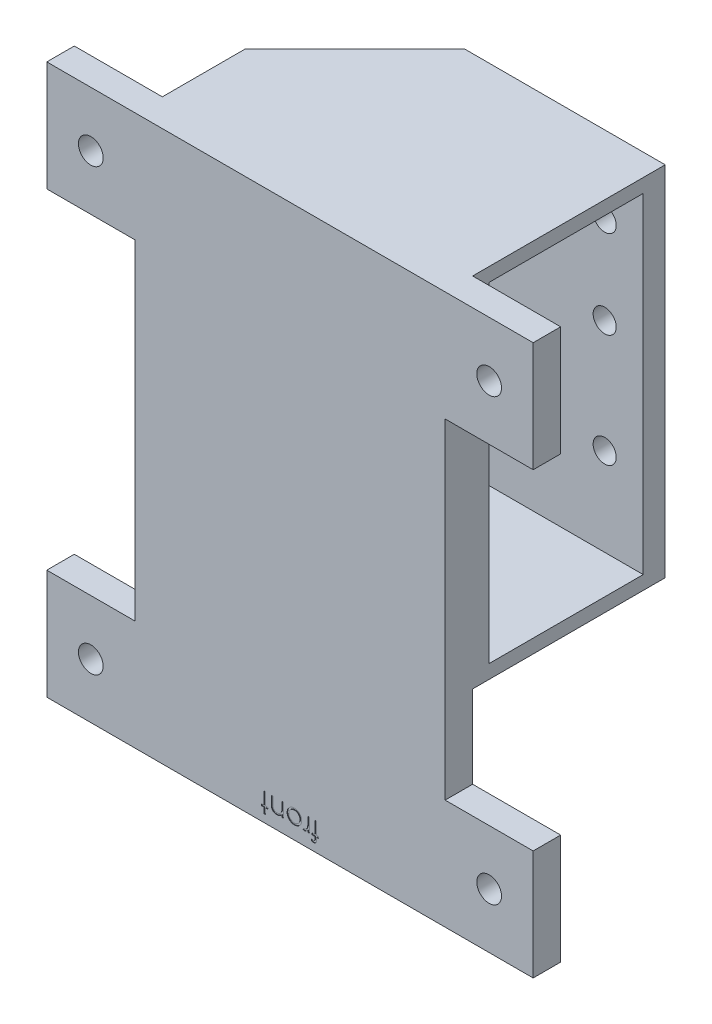
from build123d import *

# Parameters (mm, degrees)
SKETCH_2_W          = 56.4
SKETCH_2_H          = 100
EXTRUDE_1_DEPTH     = 40
CUT_EXTRUDE_1_DEPTH = 0.1
SKETCH_4_R          = 2.1
CUT_EXTRUDE_2_DEPTH = 20
SKETCH_6_W          = 5
SKETCH_6_H          = 20
EXTRUDE_2_DEPTH     = 16
HOLE_WIZARD_M4_1_D  = 4.5
SKETCH_10_W         = 35
SKETCH_10_H         = 35
CUT_EXTRUDE_3_DEPTH = 97.65278078
CHAMFER_3_SIZE      = 20
SKETCH_11_W         = 28
SKETCH_11_H         = 60
CUT_EXTRUDE_4_DEPTH = 97.65278078


with BuildPart() as part:
    # 스케치2 → 보스-돌출1 (new body)
    with BuildSketch(Plane.XY):
        Rectangle(SKETCH_2_W, SKETCH_2_H)
    extrude(amount=EXTRUDE_1_DEPTH)

    # 스케치3 → 컷-돌출1 (cut)
    # profile 1 of 5: a face of its own
    with BuildSketch(Plane.XY.offset(40)):
        Polygon((-4.419871795, -48.58974359), (-4.733974359, -48.58974359), (-4.733974359, -47.557692308), (-5.182692308, -47.557692308), (-5.182692308, -47.243589744), (-4.733974359, -47.243589744), (-4.733974359, -45), (-4.419871795, -45), (-4.419871795, -47.243589744), (-3.971153846, -47.243589744), (-3.971153846, -47.557692308), (-4.419871795, -47.557692308), align=None)
    # profile 2 of 5: a face of its own
    with BuildSketch(Plane.XY.offset(40)):
        with BuildLine():
            Line((-1.144230769, -47.557692308), (-1.458333333, -47.557692308))
            Line((-1.458333333, -47.557692308), (-1.458333333, -47.096354167))
            add(Edge.make_bspline(
                [(-1.458333333, -47.096354167), (-1.491813075, -47.138259455), (-1.556679638, -47.219450404), (-1.665816274, -47.325322597), (-1.779613315, -47.414166302), (-1.899919005, -47.484117946), (-2.025495371, -47.537022548), (-2.155986094, -47.575173001), (-2.292097456, -47.598061986), (-2.384662349, -47.60105165), (-2.431490385, -47.602564103)],
                knots=[0, 0, 0, 0, 1.127869841, 2.185233117, 3.191641716, 4.159226741, 5.10472073, 6.052603964, 7.014823782, 8, 8, 8, 8], degree=3))
            add(Edge.make_bspline(
                [(-2.431490385, -47.602564103), (-2.478843611, -47.600917497), (-2.571571757, -47.597693077), (-2.706097483, -47.56928172), (-2.83262, -47.524320566), (-2.949447493, -47.461129878), (-3.054782332, -47.382674567), (-3.146125592, -47.290645903), (-3.222940631, -47.186152591), (-3.274211104, -47.088344399), (-3.307372302, -47.001465675), (-3.329164538, -46.927156014), (-3.346794921, -46.84433245), (-3.362592431, -46.753199763), (-3.373131104, -46.653391918), (-3.381484961, -46.545147131), (-3.387460243, -46.428484144), (-3.38769794, -46.347797639), (-3.387820513, -46.306189904)],
                knots=[0, 0, 0, 0, 1.235764162, 2.419900973, 3.574701258, 4.732869372, 5.875730734, 6.993815468, 8.107424371, 9.251605764, 9.866123335, 10.534503958, 11.272175692, 12.077112099, 12.949509943, 13.89253218, 14.913238789, 16, 16, 16, 16], degree=3))
            Line((-3.387820513, -46.306189904), (-3.387820513, -45))
            Line((-3.387820513, -45), (-3.073717949, -45))
            Line((-3.073717949, -45), (-3.073717949, -46.203125))
            add(Edge.make_bspline(
                [(-3.073717949, -46.203125), (-3.07352554, -46.237947495), (-3.073157496, -46.304557001), (-3.071981473, -46.399925376), (-3.06921317, -46.486180825), (-3.065163262, -46.563571239), (-3.059494414, -46.631813366), (-3.053425809, -46.691252631), (-3.046065484, -46.741362537), (-3.039502072, -46.77152758), (-3.036558494, -46.78505609)],
                knots=[0, 0, 0, 0, 1.430803381, 2.736883362, 3.918614142, 4.976458302, 5.92063272, 6.731858525, 7.431260095, 8, 8, 8, 8], degree=3))
            add(Edge.make_bspline(
                [(-3.036558494, -46.78505609), (-3.025985705, -46.824795804), (-3.005690479, -46.901079039), (-2.954520462, -47.004374389), (-2.891402794, -47.093030698), (-2.81320145, -47.165224631), (-2.722016726, -47.221425751), (-2.617697035, -47.260391137), (-2.501322033, -47.284769891), (-2.419467122, -47.287196662), (-2.376802885, -47.288461538)],
                knots=[0, 0, 0, 0, 1.084232, 2.08126119, 3.027460722, 3.945137793, 4.874029258, 5.839697328, 6.874011781, 8, 8, 8, 8], degree=3))
            add(Edge.make_bspline(
                [(-2.376802885, -47.288461538), (-2.351532866, -47.28799256), (-2.301524152, -47.287064464), (-2.227408227, -47.277510712), (-2.155289136, -47.262421763), (-2.085360089, -47.240134352), (-2.017479764, -47.213035974), (-1.951367258, -47.17978499), (-1.887946354, -47.139565105), (-1.826325262, -47.094357903), (-1.769051064, -47.044014008), (-1.714998855, -46.991659858), (-1.667507302, -46.935103257), (-1.624398244, -46.876343857), (-1.587230651, -46.814201305), (-1.554774704, -46.749339869), (-1.527239774, -46.681656952), (-1.513556979, -46.634681994), (-1.506710737, -46.611177885)],
                knots=[0, 0, 0, 0, 1.023939463, 2.026349741, 3.024227553, 4.007104963, 4.997624259, 5.984875705, 7.002218968, 8.038748769, 9.079772093, 10.091408226, 11.086177727, 12.069739863, 13.043026652, 14.017557731, 15.008077027, 16, 16, 16, 16], degree=3))
            add(Edge.make_bspline(
                [(-1.506710737, -46.611177885), (-1.502771089, -46.593922682), (-1.49419468, -46.556359007), (-1.4849315, -46.494714588), (-1.476523924, -46.423404613), (-1.469486966, -46.342512296), (-1.465181549, -46.251754421), (-1.460487153, -46.151518583), (-1.458778092, -46.041405094), (-1.458485738, -45.964743402), (-1.458333333, -45.924779647)],
                knots=[0, 0, 0, 0, 0.615963638, 1.340920617, 2.168419149, 3.115676021, 4.16674242, 5.331190069, 6.6087489, 8, 8, 8, 8], degree=3))
            Line((-1.458333333, -45.924779647), (-1.458333333, -45))
            Line((-1.458333333, -45), (-1.144230769, -45))
            Line((-1.144230769, -45), (-1.144230769, -47.557692308))
        make_face()
    # profile 3 of 5: a face of its own
    with BuildSketch(Plane.XY.offset(40)):
        with BuildLine():
            add(Edge.make_bspline(
                [(0.806290064, -47.602564103), (0.7582976, -47.60154521), (0.664196106, -47.599547412), (0.52640509, -47.57808998), (0.395011363, -47.545551155), (0.269451285, -47.499748526), (0.150763491, -47.439653687), (0.037888294, -47.366981145), (-0.068948154, -47.281239229), (-0.132968513, -47.214875573), (-0.165464744, -47.181189904)],
                knots=[0, 0, 0, 0, 1.054042676, 2.066720093, 3.05716247, 4.025731183, 4.997454851, 5.974904663, 6.97207755, 8, 8, 8, 8], degree=3))
            add(Edge.make_bspline(
                [(-0.165464744, -47.181189904), (-0.193446698, -47.148975918), (-0.248869078, -47.085171376), (-0.319934797, -46.981715763), (-0.381156357, -46.874575662), (-0.430219318, -46.762328336), (-0.468904342, -46.645953664), (-0.496370038, -46.525051653), (-0.512706973, -46.399889306), (-0.51490994, -46.314885468), (-0.516025641, -46.271834936)],
                knots=[0, 0, 0, 0, 1.025258237, 2.030674902, 3.01204498, 3.988269485, 4.97094183, 5.956517959, 6.965070386, 8, 8, 8, 8], degree=3))
            add(Edge.make_bspline(
                [(-0.516025641, -46.271834936), (-0.515044304, -46.228534878), (-0.513105135, -46.142971945), (-0.494761519, -46.01695258), (-0.466230434, -45.894757754), (-0.42539859, -45.776899073), (-0.373040504, -45.663016196), (-0.309149729, -45.553606839), (-0.233278447, -45.448453965), (-0.147273151, -45.348454996), (-0.052226121, -45.25627808), (0.050907576, -45.175988565), (0.160175955, -45.106912047), (0.277070637, -45.052046085), (0.399927663, -45.007820299), (0.529528481, -44.977323772), (0.665757476, -44.958720064), (0.758786933, -44.956342333), (0.806290064, -44.955128205)],
                knots=[0, 0, 0, 0, 0.998669827, 1.973418153, 2.932281609, 3.89081133, 4.846438734, 5.82045571, 6.809776312, 7.834649874, 8.860672198, 9.859676908, 10.845817165, 11.837296335, 12.833502054, 13.853824644, 14.904110009, 16, 16, 16, 16], degree=3))
            add(Edge.make_bspline(
                [(0.806290064, -44.955128205), (0.854023648, -44.956352379), (0.947512284, -44.958749984), (1.084254238, -44.977185387), (1.214400716, -45.008146141), (1.337838885, -45.05149858), (1.454733093, -45.107362699), (1.564404947, -45.175719795), (1.66758729, -45.256318736), (1.762664119, -45.34844398), (1.848661426, -45.448456803), (1.924534769, -45.553606102), (1.988425008, -45.663016387), (2.040783235, -45.776899022), (2.081615042, -45.894757767), (2.110146136, -46.016952576), (2.12848975, -46.142971946), (2.130428919, -46.228534878), (2.131410256, -46.271834936)],
                knots=[0, 0, 0, 0, 1.099861214, 2.154133753, 3.1731438, 4.178222029, 5.163564916, 6.153006591, 7.15072618, 8.175428628, 9.198983792, 10.187031731, 11.15979573, 12.114193814, 13.071490482, 14.029120454, 15.002614863, 16, 16, 16, 16], degree=3))
            add(Edge.make_bspline(
                [(2.131410256, -46.271834936), (2.130289615, -46.314652437), (2.128070937, -46.399423731), (2.111711707, -46.52433693), (2.084544859, -46.644868911), (2.04532355, -46.760608083), (1.996351665, -46.872585626), (1.935746273, -46.98011856), (1.863993113, -47.083122115), (1.808786047, -47.146842045), (1.780849359, -47.179086538)],
                knots=[0, 0, 0, 0, 1.031377469, 2.041950136, 3.029500481, 4.003457997, 4.981637986, 5.969878303, 6.97268806, 8, 8, 8, 8], degree=3))
            add(Edge.make_bspline(
                [(1.780849359, -47.179086538), (1.748399431, -47.213058664), (1.684580938, -47.279870826), (1.577251317, -47.365443569), (1.464861671, -47.439095912), (1.3454083, -47.499160507), (1.219499093, -47.54546805), (1.087128821, -47.578241849), (0.948836273, -47.5994525), (0.854279, -47.601516565), (0.806290064, -47.602564103)],
                knots=[0, 0, 0, 0, 1.027951202, 2.021646915, 2.998468564, 3.9668038, 4.943370589, 5.93035926, 6.949632805, 8, 8, 8, 8], degree=3))
        make_face()
        with BuildLine():
            add(Edge.make_bspline(
                [(0.807692308, -47.288461538), (0.841629881, -47.287496895), (0.908628935, -47.285592509), (1.007249068, -47.271109357), (1.102187192, -47.248159071), (1.19363552, -47.215565268), (1.281240443, -47.173427664), (1.365098035, -47.121963826), (1.444984221, -47.060900209), (1.520280567, -46.991448366), (1.590209154, -46.916018035), (1.650583019, -46.834883677), (1.702304852, -46.750299777), (1.744565818, -46.661788259), (1.776988183, -46.569105953), (1.799960451, -46.472783139), (1.81447109, -46.372533135), (1.816351915, -46.304369998), (1.817307692, -46.269731571)],
                knots=[0, 0, 0, 0, 1.021608339, 2.016844023, 2.99486249, 3.958675159, 4.934437641, 5.916902129, 6.916234728, 7.957219854, 8.998204981, 10.008773588, 10.997243553, 11.979355116, 12.956436335, 13.948132639, 14.957303585, 16, 16, 16, 16], degree=3))
            add(Edge.make_bspline(
                [(1.817307692, -46.269731571), (1.815705109, -46.224977566), (1.81252428, -46.136149235), (1.786526694, -46.005367193), (1.743343492, -45.879576721), (1.68379675, -45.760292369), (1.610463145, -45.64973484), (1.524714534, -45.550320988), (1.425365412, -45.465884611), (1.315798809, -45.394872197), (1.197567421, -45.338949987), (1.072653449, -45.298846326), (0.942194273, -45.273127506), (0.852918677, -45.270541049), (0.807692308, -45.269230769)],
                knots=[0, 0, 0, 0, 1.016977094, 2.018509362, 3.018404954, 4.033172147, 5.041280572, 6.028085189, 7.007940189, 7.995502847, 8.989109012, 9.972200833, 10.97273166, 12, 12, 12, 12], degree=3))
            add(Edge.make_bspline(
                [(0.807692308, -45.269230769), (0.762463337, -45.270533459), (0.673182606, -45.273104934), (0.542541912, -45.298976626), (0.417285591, -45.338775602), (0.298931273, -45.394935358), (0.189314773, -45.465616203), (0.090675073, -45.550802015), (0.004188006, -45.649473499), (-0.069218213, -45.760145777), (-0.127805493, -45.879762163), (-0.171191772, -46.005344015), (-0.197127009, -46.136155138), (-0.200316253, -46.224979543), (-0.201923077, -46.269731571)],
                knots=[0, 0, 0, 0, 1.027082318, 2.027431966, 3.015401697, 4.008827937, 4.996211763, 5.971861488, 6.96198607, 7.969911943, 8.982141629, 9.981856156, 10.983207064, 12, 12, 12, 12], degree=3))
            add(Edge.make_bspline(
                [(-0.201923077, -46.269731571), (-0.20097446, -46.304372782), (-0.199107725, -46.372541399), (-0.184494602, -46.47275155), (-0.161882916, -46.569297787), (-0.128062672, -46.661414463), (-0.087274069, -46.750730658), (-0.034298302, -46.83463036), (0.025794506, -46.916069502), (0.095851282, -46.991402925), (0.171139175, -47.06115396), (0.251625502, -47.121741385), (0.33552204, -47.173457052), (0.423154649, -47.215570458), (0.514396033, -47.248033617), (0.60904592, -47.271209331), (0.707229317, -47.285539702), (0.773990463, -47.287481364), (0.807692308, -47.288461538)],
                knots=[0, 0, 0, 0, 1.043037354, 2.052538279, 3.044558847, 4.0243144, 5.003741121, 5.996211188, 7.007110229, 8.048435736, 9.089761243, 10.095031504, 11.077817236, 12.053898772, 13.018026588, 13.989527945, 14.985089051, 16, 16, 16, 16], degree=3))
        make_face(mode=Mode.SUBTRACT)
    # profile 4 of 5: a face of its own
    with BuildSketch(Plane.XY.offset(40)):
        with BuildLine():
            Line((3.567307692, -47.557692308), (3.253205128, -47.557692308))
            Line((3.253205128, -47.557692308), (3.253205128, -47.181189904))
            add(Edge.make_bspline(
                [(3.253205128, -47.181189904), (3.230033987, -47.216265089), (3.18571936, -47.283346107), (3.111673415, -47.371889133), (3.036660026, -47.446366501), (2.958127307, -47.504295055), (2.878072367, -47.548438601), (2.796732034, -47.57972352), (2.713519296, -47.598792734), (2.657348566, -47.601305296), (2.629206731, -47.602564103)],
                knots=[0, 0, 0, 0, 1.280240866, 2.448450709, 3.511242029, 4.49418232, 5.41222037, 6.289222348, 7.142891256, 8, 8, 8, 8], degree=3))
            add(Edge.make_bspline(
                [(2.629206731, -47.602564103), (2.607373332, -47.60140021), (2.562677098, -47.599017547), (2.494810983, -47.581439148), (2.42459977, -47.554439176), (2.379291072, -47.52842766), (2.355769231, -47.514923878)],
                knots=[0, 0, 0, 0, 0.90119973, 1.844890732, 2.881183062, 4, 4, 4, 4], degree=3))
            Line((2.355769231, -47.514923878), (2.528245192, -47.242888622))
            add(Edge.make_bspline(
                [(2.528245192, -47.242888622), (2.543354213, -47.249628888), (2.572034028, -47.262423203), (2.613988594, -47.277565213), (2.652669931, -47.286481129), (2.677313489, -47.287831847), (2.688802083, -47.288461538)],
                knots=[0, 0, 0, 0, 1.180555205, 2.24091978, 3.179933427, 4, 4, 4, 4], degree=3))
            add(Edge.make_bspline(
                [(2.688802083, -47.288461538), (2.714268674, -47.286856573), (2.765749172, -47.283612149), (2.840969444, -47.25589188), (2.914937028, -47.214230078), (2.972382123, -47.165086568), (3.0173577, -47.118779982), (3.049723563, -47.078030433), (3.078791731, -47.03194585), (3.106982735, -46.982271823), (3.133175951, -46.92777205), (3.156582974, -46.868354637), (3.178473187, -46.804511093), (3.190800723, -46.760119153), (3.197115385, -46.737379808)],
                knots=[0, 0, 0, 0, 1.1355652, 2.295535532, 3.545064593, 4.917862323, 5.656949634, 6.430545574, 7.239270929, 8.090880714, 8.983622437, 9.940313733, 10.94494545, 12, 12, 12, 12], degree=3))
            add(Edge.make_bspline(
                [(3.197115385, -46.737379808), (3.201855957, -46.717103757), (3.212408618, -46.671968634), (3.222395011, -46.596591234), (3.232659394, -46.507592607), (3.239668935, -46.404869363), (3.246290381, -46.288026631), (3.24994834, -46.157568472), (3.253088745, -46.013136318), (3.253165096, -45.912395458), (3.253205128, -45.859575321)],
                knots=[0, 0, 0, 0, 0.566841273, 1.261806378, 2.068780918, 3.007109044, 4.065315289, 5.256255371, 6.561408263, 8, 8, 8, 8], degree=3))
            Line((3.253205128, -45.859575321), (3.253205128, -45))
            Line((3.253205128, -45), (3.567307692, -45))
            Line((3.567307692, -45), (3.567307692, -47.557692308))
        make_face()
    # profile 5 of 5: a face of its own
    with BuildSketch(Plane.XY.offset(40)):
        with BuildLine():
            Line((3.926282051, -48.568709936), (3.926282051, -48.241987179))
            add(Edge.make_bspline(
                [(3.926282051, -48.241987179), (3.956020831, -48.253938052), (4.012465651, -48.276621056), (4.095706028, -48.301285681), (4.172234861, -48.317221421), (4.221388751, -48.319457366), (4.244591346, -48.320512821)],
                knots=[0, 0, 0, 0, 1.16548392, 2.212112691, 3.15604595, 4, 4, 4, 4], degree=3))
            add(Edge.make_bspline(
                [(4.244591346, -48.320512821), (4.260506628, -48.319901347), (4.29086446, -48.318734983), (4.334597978, -48.311913229), (4.373878754, -48.29942109), (4.408524105, -48.281814066), (4.43736084, -48.260709259), (4.462146155, -48.239226826), (4.480074637, -48.215042461), (4.489950849, -48.19253823), (4.495611497, -48.171610651), (4.498818247, -48.150454135), (4.501587796, -48.12378309), (4.503354012, -48.091715067), (4.50570618, -48.054579141), (4.50697213, -48.012027215), (4.507671623, -47.964111878), (4.507566904, -47.930222012), (4.507512019, -47.912459936)],
                knots=[0, 0, 0, 0, 1.331338734, 2.53948105, 3.689136299, 4.764273871, 5.773054392, 6.672324186, 7.497148657, 8.267121549, 8.712809866, 9.307239488, 10.054042404, 10.955009736, 11.992538323, 13.165873169, 14.514600855, 16, 16, 16, 16], degree=3))
            Line((4.507512019, -47.912459936), (4.507512019, -47.557692308))
            Line((4.507512019, -47.557692308), (3.971153846, -47.557692308))
            Line((3.971153846, -47.557692308), (3.971153846, -47.243589744))
            Line((3.971153846, -47.243589744), (4.508213141, -47.243589744))
            Line((4.508213141, -47.243589744), (4.509615385, -45))
            Line((4.509615385, -45), (4.823717949, -45))
            Line((4.823717949, -45), (4.823717949, -47.243589744))
            Line((4.823717949, -47.243589744), (5.182692308, -47.243589744))
            Line((5.182692308, -47.243589744), (5.182692308, -47.557692308))
            Line((5.182692308, -47.557692308), (4.823717949, -47.557692308))
            Line((4.823717949, -47.557692308), (4.823717949, -47.966446314))
            add(Edge.make_bspline(
                [(4.823717949, -47.966446314), (4.823577243, -47.989116565), (4.823307369, -48.032598062), (4.82143135, -48.095517086), (4.817137755, -48.153257595), (4.81165473, -48.206127376), (4.804611249, -48.253832801), (4.796712641, -48.296620157), (4.785863496, -48.334212004), (4.770570553, -48.377506645), (4.745243672, -48.425953118), (4.706187127, -48.47787473), (4.657732881, -48.523473283), (4.60185933, -48.563867221), (4.53759293, -48.594870492), (4.467338317, -48.618716867), (4.390189507, -48.631605259), (4.336715337, -48.633590142), (4.309094551, -48.634615385)],
                knots=[0, 0, 0, 0, 1.116345288, 2.14114814, 3.098813152, 3.966817096, 4.757784664, 5.473233334, 6.10711986, 6.682294791, 7.732310636, 8.784153748, 9.86671089, 10.99714404, 12.165429041, 13.36635898, 14.639656577, 16, 16, 16, 16], degree=3))
            add(Edge.make_bspline(
                [(4.309094551, -48.634615385), (4.281003664, -48.633754034), (4.222228985, -48.631951825), (4.130295617, -48.617876852), (4.030379183, -48.598184904), (3.961917534, -48.578800077), (3.926282051, -48.568709936)],
                knots=[0, 0, 0, 0, 0.86485554, 1.80954081, 2.859827752, 4, 4, 4, 4], degree=3))
        make_face()
    extrude(amount=-CUT_EXTRUDE_1_DEPTH, mode=Mode.SUBTRACT)

    # 스케치4 → 컷-돌출2 (cut)
    with BuildSketch(Plane(origin=(0, 0, 0), x_dir=(-1, 0, 0), z_dir=(0, 0, -1))):
        with Locations((-21.2, 40)):
            Circle(SKETCH_4_R)
        with Locations((-21.2, 24)):
            Circle(SKETCH_4_R)
        with Locations((-21.2, 3.5)):
            Circle(SKETCH_4_R)
    extrude(amount=-CUT_EXTRUDE_2_DEPTH, mode=Mode.SUBTRACT)

    # 스케치6 → 보스-돌출2 (add)
    with BuildSketch(Plane.ZY.offset(28.2)):
        with Locations((37.5, -40)):
            Rectangle(SKETCH_6_W, SKETCH_6_H)
        with Locations((37.5, 40)):
            Rectangle(SKETCH_6_W, SKETCH_6_H)
    extrude_2 = extrude(amount=EXTRUDE_2_DEPTH)

    # 대칭 복사1: 보스-돌출2 across plane
    add(extrude_2.mirror(Plane.ZY))

    # M4 여유 구멍1 (through all)
    with Locations(Plane.XY.offset(40)):
        with Locations((-36.2, -40), (-36.2, 40), (36.2, 40), (36.2, -40)):
            Hole(HOLE_WIZARD_M4_1_D / 2)

    # 스케치10 → 컷-돌출3 (cut, through all)
    with BuildSketch(Plane.ZY.offset(28.2)):
        with Locations((17.5, -32.5)):
            Rectangle(SKETCH_10_W, SKETCH_10_H)
    extrude(amount=-CUT_EXTRUDE_3_DEPTH, mode=Mode.SUBTRACT)

    # 모따기3
    chamfer_3_edges = [part.edges().sort_by_distance(p)[0] for p in [
        (-28.2, 17.5, 0),
    ]]
    chamfer(chamfer_3_edges, length=CHAMFER_3_SIZE)

    # 스케치11 → 컷-돌출4 (cut, through all)
    with BuildSketch(Plane(origin=(28.2, 0, 0), x_dir=(0, 0, -1), z_dir=(1, 0, 0))):
        with Locations((-18, 17.5)):
            Rectangle(SKETCH_11_W, SKETCH_11_H)
    extrude(amount=-CUT_EXTRUDE_4_DEPTH, mode=Mode.SUBTRACT)


solid = part.part
